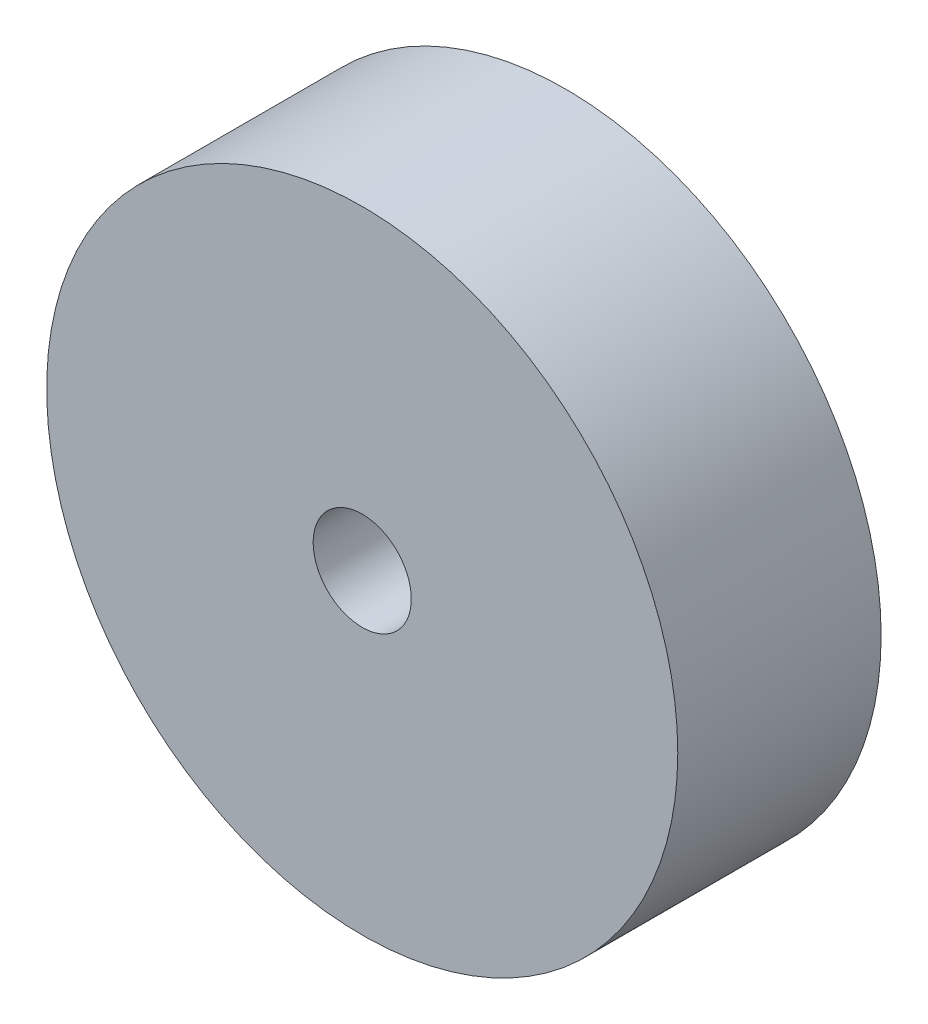
from build123d import *

# Parameters (mm, degrees)
SKETCH1_R           = 9
BOSS_EXTRUDE1_DEPTH = 5.8
SKETCH2_R           = 6.4
CUT_EXTRUDE1_DEPTH  = 3.2
SKETCH3_R           = 1
BOSS_EXTRUDE2_DEPTH = 3
SKETCH4_R           = 3.15
BOSS_EXTRUDE3_DEPTH = 3
SKETCH5_R           = 1.4
CUT_EXTRUDE2_DEPTH  = 40.9523428


with BuildPart() as part:
    # Sketch1 → Boss-Extrude1 (new body)
    with BuildSketch(Plane.XY):
        with Locations((-29.082250471, -1.703826149)):
            Circle(SKETCH1_R)
    extrude(amount=BOSS_EXTRUDE1_DEPTH)

    # Sketch2 → Cut-Extrude1 (cut)
    with BuildSketch(Plane(origin=(0, 0, 0), x_dir=(-1, 0, 0), z_dir=(0, 0, -1))):
        with Locations((29.082250471, -1.703826149)):
            Circle(SKETCH2_R)
    extrude(amount=-CUT_EXTRUDE1_DEPTH, mode=Mode.SUBTRACT)

    # Sketch3 → Boss-Extrude2 (add)
    with BuildSketch(Plane(origin=(0, 0, 3.2), x_dir=(-1, 0, 0), z_dir=(0, 0, -1))):
        with Locations((29.082250471, -1.703826149)):
            Circle(SKETCH3_R)
    extrude(amount=BOSS_EXTRUDE2_DEPTH)

    # Sketch4 → Boss-Extrude3 (add)
    with BuildSketch(Plane(origin=(0, 0, 0.2), x_dir=(-1, 0, 0), z_dir=(0, 0, -1))):
        with Locations((29.082250471, -1.703826149)):
            Circle(SKETCH4_R)
    extrude(amount=-BOSS_EXTRUDE3_DEPTH)

    # Sketch5 → Cut-Extrude2 (cut, through all)
    with BuildSketch(Plane(origin=(0, 0, 0.2), x_dir=(-1, 0, 0), z_dir=(0, 0, -1))):
        with Locations((29.082250471, -1.703826149)):
            Circle(SKETCH5_R)
    extrude(amount=-CUT_EXTRUDE2_DEPTH, mode=Mode.SUBTRACT)


solid = part.part
